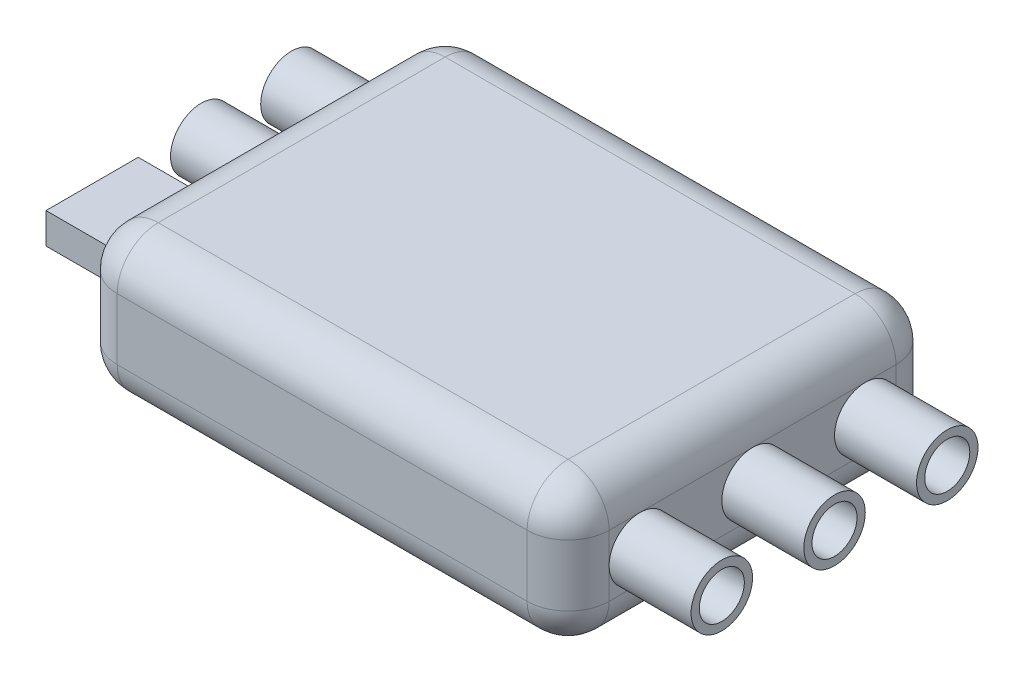
from build123d import *

# Parameters (mm, degrees)
EXTRUDE_1_DEPTH = 7
FILLET_1_R      = 2
SKETCH_3_R      = 1.5
SKETCH_3_R_2    = 1.1
EXTRUDE_2_DEPTH = 4
EXTRUDE_START   = 4
SKETCH_4_R      = 1.5
SKETCH_4_R_2    = 1.1
SKETCH_4_W      = 4.5
SKETCH_4_H      = 1.5
EXTRUDE_3_DEPTH = 4


with BuildPart() as part:
    # 草图2 → 凸台-拉伸1 (new body)
    with BuildSketch(Plane(origin=(0, 0, 0), x_dir=(1, 0, 0), z_dir=(0, 1, 0))):
        with BuildLine():
            Line((10, -9), (-10, -9))
            ThreePointArc((-10, -9), (-11.414213562, -8.414213562), (-12, -7))
            Line((-12, -7), (-12, 7))
            ThreePointArc((-12, 7), (-11.414213562, 8.414213562), (-10, 9))
            Line((-10, 9), (10, 9))
            ThreePointArc((10, 9), (11.414213562, 8.414213562), (12, 7))
            Line((12, 7), (12, -7))
            ThreePointArc((12, -7), (11.414213562, -8.414213562), (10, -9))
        make_face()
    extrude(amount=EXTRUDE_1_DEPTH)

    # 圆角1
    fillet_1_edges = [part.edges().sort_by_distance(p)[0] for p in [
        (11.414213562, 7, 8.414213562),
        (0, 0, 9),
        (-11.414213562, 0, 8.414213562),
        (12, 7, 0),
        (11.414213562, 7, -8.414213562),
        (0, 7, -9),
        (-11.414213562, 7, -8.414213562),
        (-12, 7, 0),
        (-11.414213562, 7, 8.414213562),
        (0, 7, 9),
        (-12, 0, 0),
        (-11.414213562, 0, -8.414213562),
        (0, 0, -9),
        (11.414213562, 0, -8.414213562),
        (12, 0, 0),
        (11.414213562, 0, 8.414213562),
    ]]
    fillet(fillet_1_edges, radius=FILLET_1_R)

    # 草图3 → 凸台-拉伸2 (add)
    # profile 1 of 3: a face of its own
    with BuildSketch(Plane(origin=(12, 0, 0), x_dir=(0, 0, -1), z_dir=(1, 0, 0))):
        with Locations(Location((0, 3.5, 0), (0, 0, 270))):
            Circle(SKETCH_3_R)
        with Locations((0, 3.5)):
            Circle(SKETCH_3_R_2, mode=Mode.SUBTRACT)
    # profile 2 of 3: a face of its own
    with BuildSketch(Plane(origin=(12, 0, 0), x_dir=(0, 0, -1), z_dir=(1, 0, 0))):
        with Locations(Location((-5.5, 3.5, 0), (0, 0, 180))):
            Circle(SKETCH_3_R)
        with Locations((-5.5, 3.5)):
            Circle(SKETCH_3_R_2, mode=Mode.SUBTRACT)
    # profile 3 of 3: a face of its own
    with BuildSketch(Plane(origin=(12, 0, 0), x_dir=(0, 0, -1), z_dir=(1, 0, 0))):
        with Locations((5.5, 3.5)):
            Circle(SKETCH_3_R)
        with Locations((5.5, 3.5)):
            Circle(SKETCH_3_R_2, mode=Mode.SUBTRACT)
    extrude(amount=EXTRUDE_2_DEPTH)

    # 草图4 → 凸台-拉伸3 (add)
    # profile 1 of 3: a face of its own
    with BuildSketch(Plane.ZY.offset(12).offset(EXTRUDE_START)):
        with Locations(Location((-5.5, 3.5, 0), (0, 0, 180))):
            Circle(SKETCH_4_R)
        with Locations(Location((-5.5, 3.5, 0), (0, 0, 180))):
            Circle(SKETCH_4_R_2, mode=Mode.SUBTRACT)
    # profile 2 of 3: a face of its own
    with BuildSketch(Plane.ZY.offset(12).offset(EXTRUDE_START)):
        with Locations(Location((-1.1, 3.5, 0), (0, 0, 270))):
            Circle(SKETCH_4_R)
        with Locations((-1.1, 3.5)):
            Circle(SKETCH_4_R_2, mode=Mode.SUBTRACT)
    # profile 3 of 3: a face of its own
    with BuildSketch(Plane.ZY.offset(12).offset(EXTRUDE_START)):
        with Locations((4.224899284, 3.5)):
            Rectangle(SKETCH_4_W, SKETCH_4_H)
    extrude(amount=-EXTRUDE_3_DEPTH)


solid = part.part
